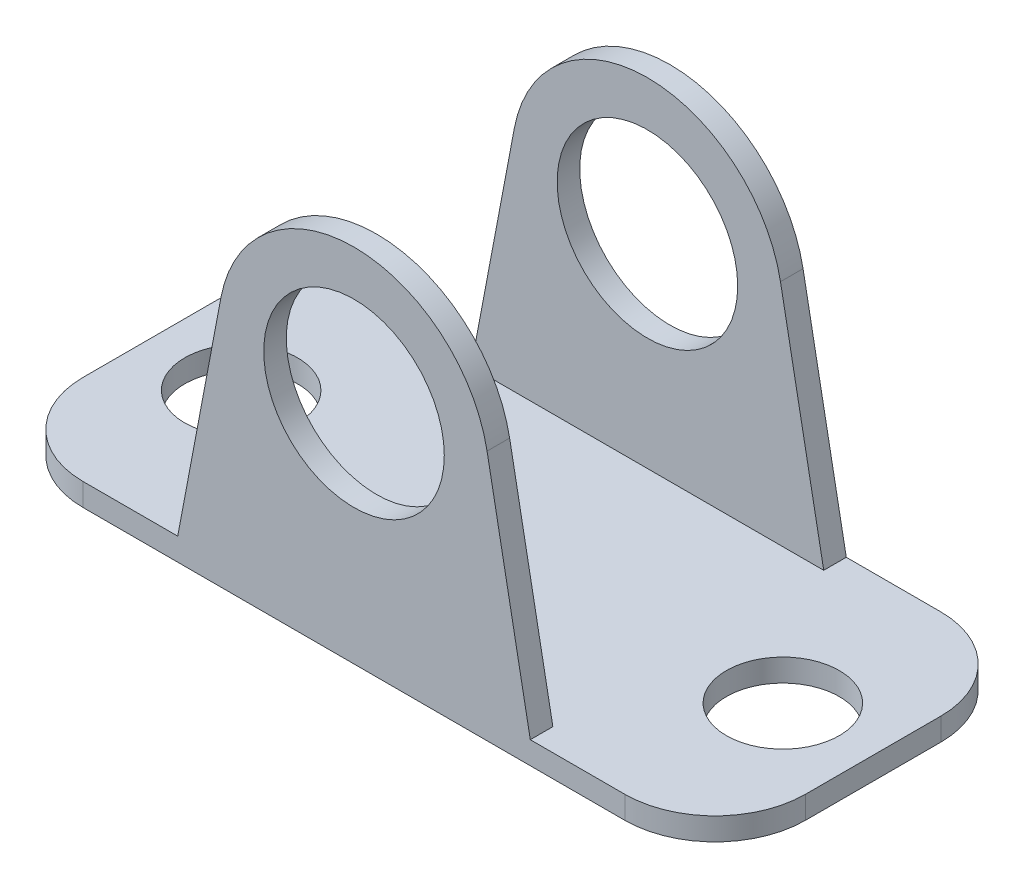
from build123d import *

# Parameters (mm, degrees)
SKETCH_1_R      = 2
EXTRUDE_1_DEPTH = 0.5
EXTRUDE_2_DEPTH = 3
SKETCH_4_W      = 7
SKETCH_4_H      = 0.5
EXTRUDE_3_DEPTH = 8
F_2_5MM_1_D     = 2.5
FILLET_1_R      = 2


with BuildPart() as part:
    # 草圖1 → 填料-伸長1 (new body)
    with BuildSketch(Plane.XY):
        with BuildLine():
            Line((-4, 0), (4, 0))
            Line((4, 0), (2.947629603, 5.558103683))
            ThreePointArc((2.947629603, 5.558103683), (0, 8), (-2.947629603, 5.558103683))
            Line((-2.947629603, 5.558103683), (-4, 0))
        make_face()
        with Locations((0, 5)):
            Circle(SKETCH_1_R, mode=Mode.SUBTRACT)
    extrude(amount=EXTRUDE_1_DEPTH)

    # 草圖1<3> → 填料-伸長2 (add)
    with BuildSketch(Plane.XY):
        Polygon((-3.905330086, 0.5), (-4, 0), (4, 0), (3.905330086, 0.5), align=None)
    extrude(amount=-EXTRUDE_2_DEPTH)

    # 鏡射1: part across plane


with BuildPart() as part_1:
    add(part.part)
    add(part.part.mirror(Plane.XY.offset(-3)))

    # 草圖4 → 填料-伸長3 (add, symmetric)
    with BuildSketch(Plane(origin=(0, 0, 0), x_dir=(0, 0, -1), z_dir=(1, 0, 0))):
        with Locations((3, 0.25)):
            Rectangle(SKETCH_4_W, SKETCH_4_H)
    extrude(amount=EXTRUDE_3_DEPTH, both=True)

    # Ø2.5mm 定位孔1 (through all)
    with Locations(Plane(origin=(0, 0.5, 0), x_dir=(1, 0, 0), z_dir=(0, 1, 0))):
        with Locations((-6, 3), (6, 3)):
            Hole(F_2_5MM_1_D / 2)

    # 圓角1
    fillet_1_edges = [part_1.edges().sort_by_distance(p)[0] for p in [
        (-8, 0.25, 0.5),
        (-8, 0.25, -6.5),
        (8, 0.25, 0.5),
        (8, 0.25, -6.5),
    ]]
    fillet(fillet_1_edges, radius=FILLET_1_R)


solid = part_1.part
